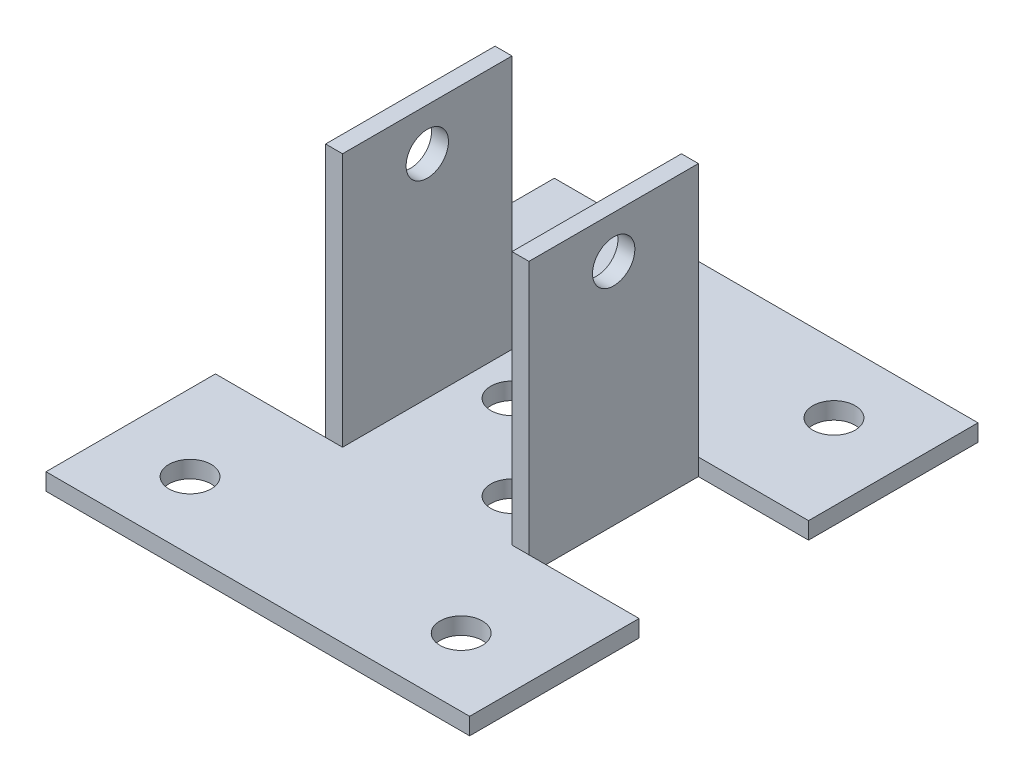
from build123d import *

# Parameters (mm, degrees)
RESSALTO_EXTRUS_O1_DEPTH      = 2
RESSALTO_EXTRUS_O3_DEPTH      = 30
RESSALTO_EXTRUS_O3_DEPTH_BACK = 2
ESBO_O2_W                     = 2
ESBO_O2_H                     = 20
ESBO_O3_R                     = 2.5
CORTE_EXTRUS_O1_DEPTH         = 2
CORTE_EXTRUS_O2_DEPTH         = 50.244289009
CORTE_EXTRUS_O2_DEPTH_BACK    = 50.244289009
ESBO_O4_R                     = 2.5


with BuildPart() as part:
    # Esboço1 → Ressalto-extrusão1 (new body)
    with BuildSketch(Plane(origin=(0, 0, 0), x_dir=(1, 0, 0), z_dir=(0, 1, 0))):
        Polygon((10, 10), (10, -10), (25, -10), (25, -30), (-25, -30), (-25, -10), (-10, -10), (-10, 10), (-25, 10), (-25, 30), (25, 30), (25, 10), align=None)
    extrude(amount=-RESSALTO_EXTRUS_O1_DEPTH)

    # Esboço2 → Ressalto-extrusão3 (add, two sides: drawn at the far end of the back side and taken through both)
    with BuildSketch(Plane(origin=(0, 0, 0), x_dir=(1, 0, 0), z_dir=(0, 1, 0)).offset(-RESSALTO_EXTRUS_O3_DEPTH_BACK)):
        with Locations((-11, 0)):
            Rectangle(ESBO_O2_W, ESBO_O2_H)
        with Locations((11, 0)):
            Rectangle(ESBO_O2_W, ESBO_O2_H)
    extrude(amount=RESSALTO_EXTRUS_O3_DEPTH + RESSALTO_EXTRUS_O3_DEPTH_BACK)

    # Esboço3 → Corte-extrusão1 (cut)
    with BuildSketch(Plane(origin=(0, 0, 0), x_dir=(1, 0, 0), z_dir=(0, 1, 0))):
        with Locations(Location((16, -22, 0), (0, 0, 270))):
            Circle(ESBO_O3_R)
        with Locations(Location((-16, -22, 0), (0, 0, 270))):
            Circle(ESBO_O3_R)
        with Locations(Location((5, -5, 0), (0, 0, 270))):
            Circle(ESBO_O3_R)
        with Locations(Location((-5, 5, 0), (0, 0, 270))):
            Circle(ESBO_O3_R)
        with Locations(Location((16, 22, 0), (0, 0, 270))):
            Circle(ESBO_O3_R)
        with Locations(Location((-16, 22, 0), (0, 0, 270))):
            Circle(ESBO_O3_R)
    extrude(amount=-CORTE_EXTRUS_O1_DEPTH, mode=Mode.SUBTRACT)

    # Esboço4 → Corte-extrusão2 (cut, two sides: drawn at the far end of the back side and taken through both)
    with BuildSketch(Plane(origin=(0, 0, 0), x_dir=(0, 0, -1), z_dir=(1, 0, 0)).offset(-CORTE_EXTRUS_O2_DEPTH_BACK)):
        with Locations((0, 25)):
            Circle(ESBO_O4_R)
    extrude(amount=CORTE_EXTRUS_O2_DEPTH + CORTE_EXTRUS_O2_DEPTH_BACK, mode=Mode.SUBTRACT)


solid = part.part
